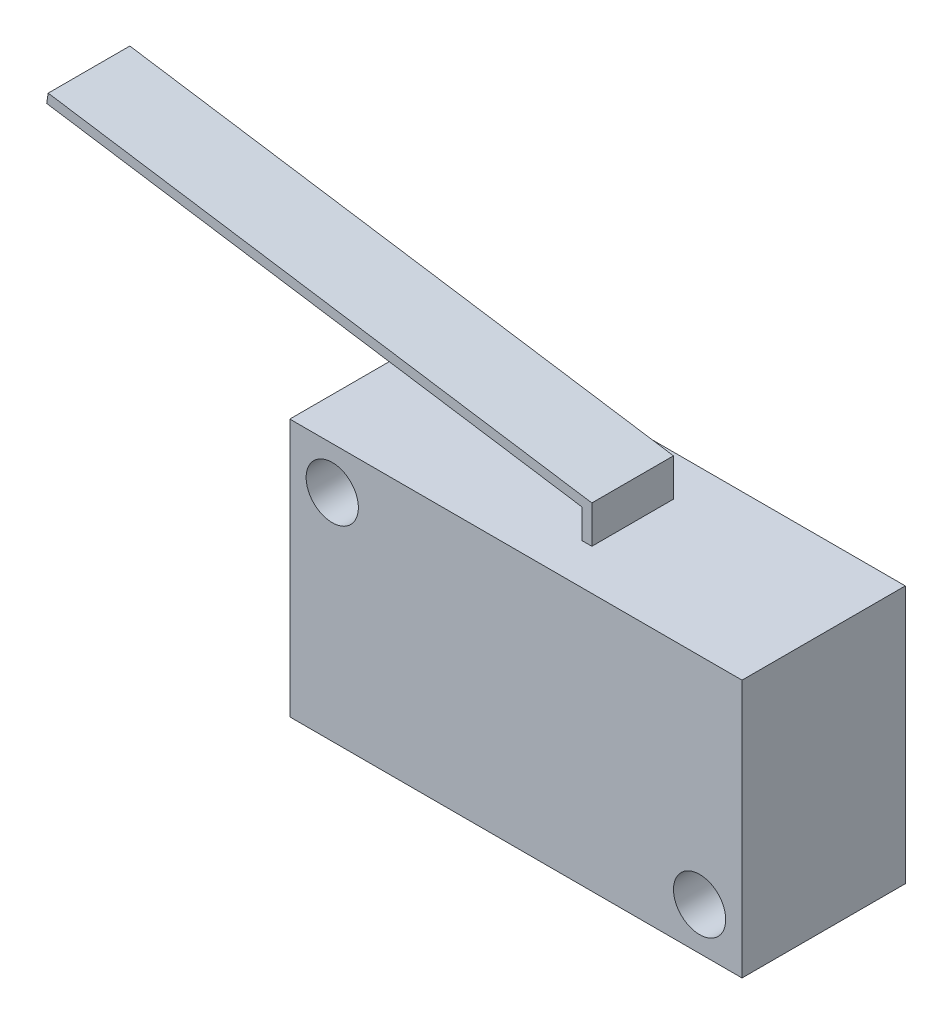
from build123d import *

# Parameters (mm, degrees)
SKETCH_1_W        = 27.7
SKETCH_1_H        = 15.8
SKETCH_1_R        = 1.6
EXTRUDE_1_DEPTH   = 5
EXTRUDE_1_2_DEPTH = 2.5


with BuildPart() as part:
    # ｽｹｯﾁ1 → Extrude 1 (new, symmetric)
    with BuildSketch(Plane.XY):
        Rectangle(SKETCH_1_W, SKETCH_1_H)
        with Locations((-11.25, 5.3)):
            Circle(SKETCH_1_R, mode=Mode.SUBTRACT)
        with Locations((11.25, -5.3)):
            Circle(SKETCH_1_R, mode=Mode.SUBTRACT)
    extrude(amount=EXTRUDE_1_DEPTH, both=True)

    # ｽｹｯﾁ2 → Extrude 1 2 (add, symmetric)
    with BuildSketch(Plane.XY):
        Polygon((2.15, 7.9), (2.15, 10.2), (-31.15, 15.288694067), (-31.240636022, 14.695579313), (1.55, 9.684723007), (1.55, 7.9), align=None)
    extrude(amount=EXTRUDE_1_2_DEPTH, both=True)


solid = part.part
